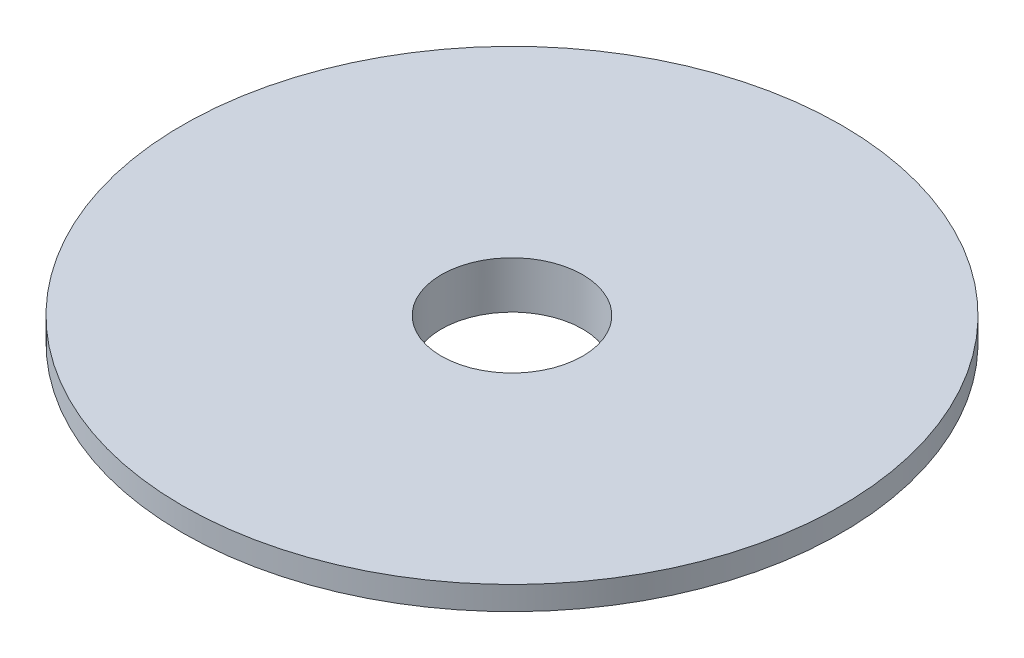
from build123d import *
from build123d.topology import SkipClean

# Parameters (mm, degrees)
SKETCH1_R           = 88.9
SKETCH1_R_2         = 19.05
BOSS_EXTRUDE1_DEPTH = 6.35
BOSS_EXTRUDE3_START = 6.35
SKETCH3_R           = 25.4
SKETCH3_R_2         = 19.05
BOSS_EXTRUDE3_DEPTH = 6.35


with BuildPart() as part:
    # Sketch1 → Boss-Extrude1 (new body)
    with BuildSketch(Plane(origin=(0, 0, 0), x_dir=(1, 0, 0), z_dir=(0, 1, 0))):
        with Locations(Location((0, 0, 0), (0, 0, 270))):
            Circle(SKETCH1_R)
        with Locations(Location((0, 0, 0), (0, 0, 270))):
            Circle(SKETCH1_R_2, mode=Mode.SUBTRACT)
    extrude(amount=BOSS_EXTRUDE1_DEPTH)

    # Sketch3 → Boss-Extrude3 (add)
    with SkipClean():  # the faces are left unmerged after this step: merging them gives an invalid solid
        with BuildSketch(Plane.XZ.offset(BOSS_EXTRUDE3_START)):
            with Locations(Location((0, 0, 0), (0, 0, 90))):
                Circle(SKETCH3_R)
            with Locations(Location((0, 0, 0), (0, 0, 270))):
                Circle(SKETCH3_R_2, mode=Mode.SUBTRACT)
        extrude(amount=-BOSS_EXTRUDE3_DEPTH)


solid = part.part
